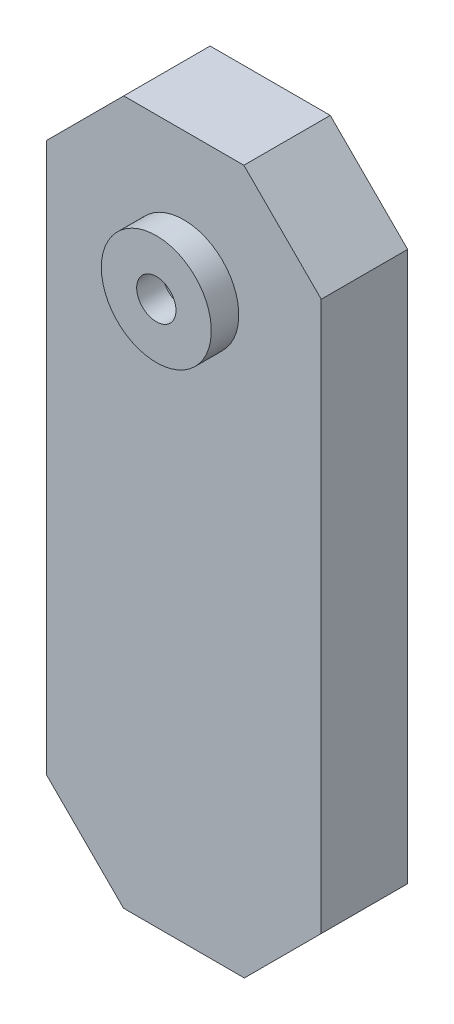
from build123d import *

# Parameters (mm, degrees)
EXTRUDE_1_DEPTH     = 66
SKETCH1_R           = 3.5
BOSS_EXTRUDE1_DEPTH = 50
SKETCH2_R           = 42
BOSS_EXTRUDE2_DEPTH = 21
SKETCH3_R           = 15
CUT_EXTRUDE1_DEPTH  = 20


with BuildPart() as part:
    # Эскиз1 → Вытянуть1 (new body)
    with BuildSketch(Plane.XY):
        Polygon((105.082921559, 581.722068254), (45.979042749, 640.825947064), (-45.813199631, 640.825947064), (-104.917078441, 581.722068254), (-104.917078441, 162.212880509), (-45.97317451, 103.268976578), (46.326817337, 103.268976578), (105.082921559, 162.0250808), align=None)
    extrude(amount=EXTRUDE_1_DEPTH)

    # Sketch2 → Boss-Extrude2 (add)
    with BuildSketch(Plane.XY.offset(66)):
        with Locations(Location((0.082921559, 539.825947064, 0), (0, 0, 180))):
            Circle(SKETCH2_R)
    extrude(amount=BOSS_EXTRUDE2_DEPTH)

    # Sketch3 → Cut-Extrude1 (cut)
    with BuildSketch(Plane.XY.offset(87)):
        with Locations((0.082921559, 539.825947064)):
            Circle(SKETCH3_R)
    extrude(amount=-CUT_EXTRUDE1_DEPTH, mode=Mode.SUBTRACT)


with BuildPart() as body_2:
    # Sketch1 → Boss-Extrude1 (new body)
    with BuildSketch(Plane(origin=(0, 490.825947064, 0), x_dir=(1, 0, 0), z_dir=(0, 1, 0))):
        with Locations(Location((-108.417078441, 0, 0), (0, 0, 180))):
            Circle(SKETCH1_R)
    extrude(amount=BOSS_EXTRUDE1_DEPTH)


solid = Compound([part.part, body_2.part])
